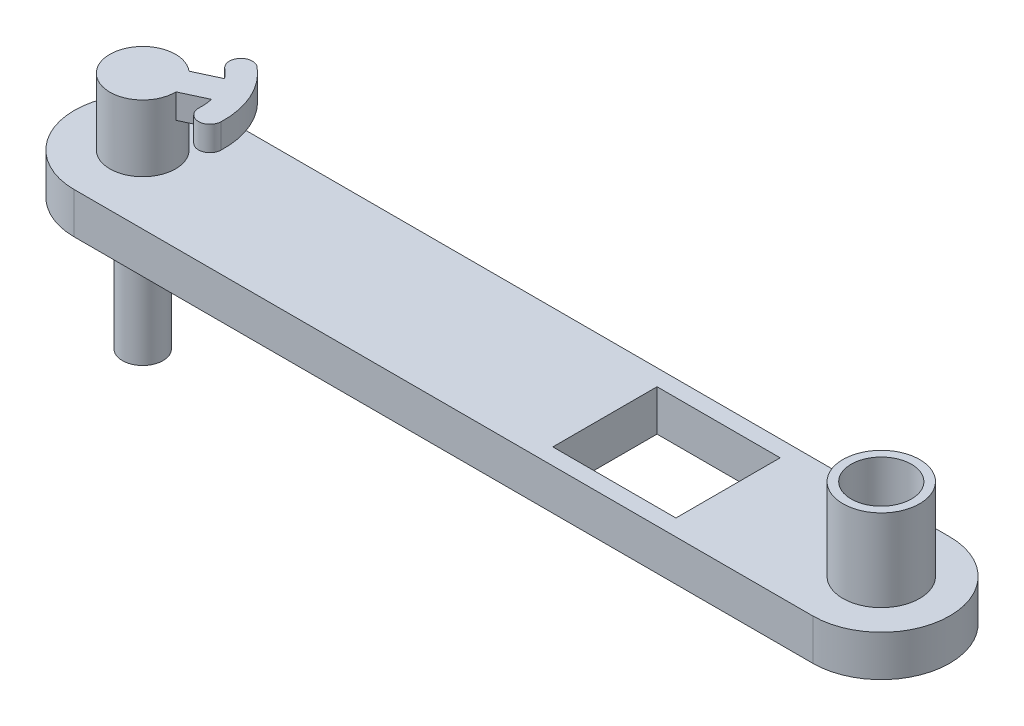
from build123d import *

# Parameters (mm, degrees)
CORPS_DEPTH             = 5
ESQUISSE1_R             = 2.475
PULLEY_HOLD_DEPTH       = 16
ESQUISSE2_R             = 4
KNOB_HOLD_DEPTH         = 8.1
KNOB_START              = 5.1
KNOB_DEPTH              = 3
ESQUISSE3_R             = 3.675
ESQUISSE3_W             = 15
ESQUISSE3_H             = 12.7
ENL_V_MAT_EXTRU_1_DEPTH = 100.992224698
ESQUISSE5_R             = 4.675
ESQUISSE5_R_2           = 3.675
BOSS_EXTRU_1_DEPTH      = 10


with BuildPart() as part:
    # Sketch1 → corps (new body)
    with BuildSketch(Plane(origin=(0, 0, 0), x_dir=(1, 0, 0), z_dir=(0, 1, 0))):
        with BuildLine():
            Line((0, 8.35), (90, 8.35))
            ThreePointArc((90, 8.35), (98.35, 0), (90, -8.35))
            Line((90, -8.35), (0, -8.35))
            ThreePointArc((0, -8.35), (-8.35, 0), (0, 8.35))
        make_face()
    extrude(amount=CORPS_DEPTH)

    # Esquisse1 → pulley hold (add)
    with BuildSketch(Plane.XZ):
        with Locations(Location((0, 0, 0), (0, 0, 90))):
            Circle(ESQUISSE1_R)
    extrude(amount=PULLEY_HOLD_DEPTH)

    # Esquisse2 → knob hold (add)
    with BuildSketch(Plane(origin=(0, 5, 0), x_dir=(1, 0, 0), z_dir=(0, 1, 0))):
        with Locations(Location((0, 0, 0), (0, 0, 270))):
            Circle(ESQUISSE2_R)
    extrude(amount=KNOB_HOLD_DEPTH)

    # Esquisse4 → knob (add)
    with BuildSketch(Plane(origin=(0, 5, 0), x_dir=(1, 0, 0), z_dir=(0, 1, 0)).offset(KNOB_START)):
        with BuildLine():
            Line((3.999579917, 0.057969697), (6.953398299, 1.435357829))
            ThreePointArc((6.953398299, 1.435357829), (7.074856515, 0.596996899), (7.095602071, -0.249862457))
            ThreePointArc((7.095602071, -0.249862457), (8.44546622, -1.698263913), (9.893867677, -0.348399764))
            ThreePointArc((9.893867677, -0.348399764), (9.026569148, 4.065839324), (6.295408565, 7.640538659))
            ThreePointArc((6.295408565, 7.640538659), (4.324668554, 7.450318241), (4.514888971, 5.47957823))
            ThreePointArc((4.514888971, 5.47957823), (5.06564099, 4.974864959), (5.560313894, 4.415077508))
            Line((5.560313894, 4.415077508), (2.603837765, 3.036450048))
            ThreePointArc((2.603837765, 3.036450048), (3.622032243, 1.697316243), (3.999579917, 0.057969697))
        make_face()
    extrude(amount=KNOB_DEPTH)

    # Esquisse3 → Enlèv. mat.-Extru.1 (cut, through all)
    with BuildSketch(Plane.XZ):
        with Locations(Location((90, 0, 0), (0, 0, 270))):
            Circle(ESQUISSE3_R)
        with Locations((63.825, 0)):
            Rectangle(ESQUISSE3_W, ESQUISSE3_H)
    extrude(amount=-ENL_V_MAT_EXTRU_1_DEPTH, mode=Mode.SUBTRACT)

    # Esquisse5 → Boss.-Extru.1 (add)
    with BuildSketch(Plane(origin=(0, 5, 0), x_dir=(1, 0, 0), z_dir=(0, 1, 0))):
        with Locations(Location((90, 0, 0), (0, 0, 270))):
            Circle(ESQUISSE5_R)
        with Locations(Location((90, 0, 0), (0, 0, 90))):
            Circle(ESQUISSE5_R_2, mode=Mode.SUBTRACT)
    extrude(amount=BOSS_EXTRU_1_DEPTH)


solid = part.part
